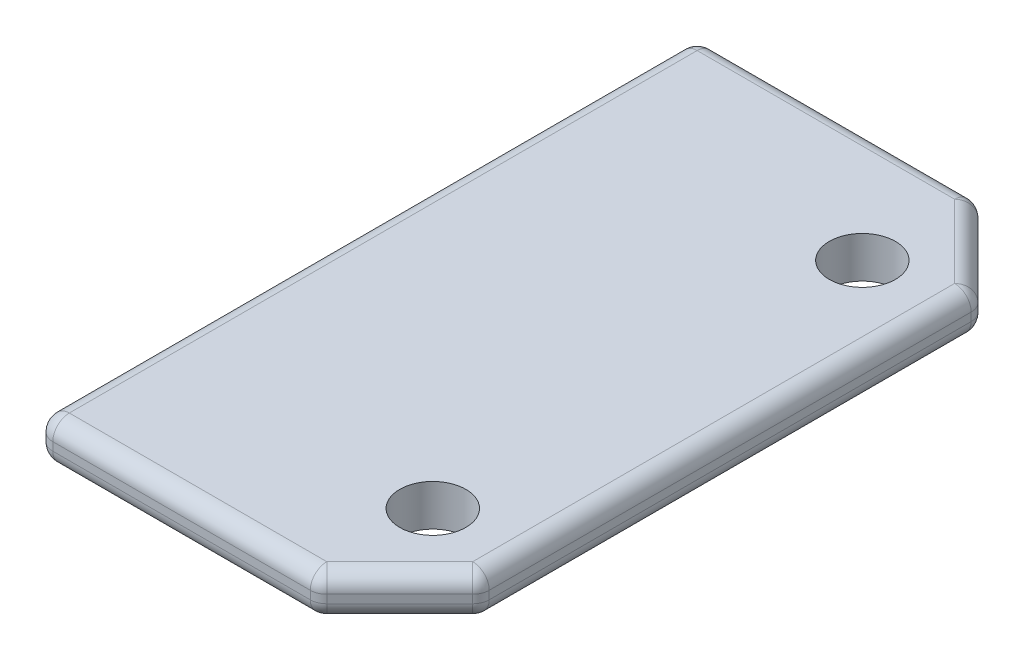
from build123d import *

# Parameters (mm, degrees)
SKETCH_1_R      = 2
EXTRUDE_1_DEPTH = 2.5
FILLET_1_R      = 1


with BuildPart() as part:
    # 草图1 → 凸台-拉伸1 (new body)
    with BuildSketch(Plane(origin=(0, 0, 0), x_dir=(1, 0, 0), z_dir=(0, 1, 0))):
        with BuildLine():
            Line((29.554766525, 4.641792145), (29.554766525, 7.641792145))
            Line((29.554766525, 7.641792145), (29.554766525, 42.641792145))
            ThreePointArc((29.554766525, 42.641792145), (29.847659744, 43.348898926), (30.554766525, 43.641792145))
            Line((30.554766525, 43.641792145), (46.140552963, 43.641792145))
            ThreePointArc((46.140552963, 43.641792145), (46.523236395, 43.565671677), (46.847659744, 43.348898926))
            Line((46.847659744, 43.348898926), (51.261873307, 38.934685364))
            ThreePointArc((51.261873307, 38.934685364), (51.478646058, 38.610262015), (51.554766525, 38.227578582))
            Line((51.554766525, 38.227578582), (51.554766525, 31.641792145))
            Line((51.554766525, 31.641792145), (51.554766525, 15.641792145))
            Line((51.554766525, 15.641792145), (51.554766525, 9.056005707))
            ThreePointArc((51.554766525, 9.056005707), (51.478646058, 8.673322275), (51.261873307, 8.348898926))
            Line((51.261873307, 8.348898926), (46.847659744, 3.934685364))
            ThreePointArc((46.847659744, 3.934685364), (46.523236395, 3.717912612), (46.140552963, 3.641792145))
            Line((46.140552963, 3.641792145), (30.554766525, 3.641792145))
            ThreePointArc((30.554766525, 3.641792145), (29.847659744, 3.934685364), (29.554766525, 4.641792145))
        make_face()
        with Locations(Location((46.554766525, 10.641792145, 0), (0, 0, 270))):
            Circle(SKETCH_1_R, mode=Mode.SUBTRACT)
        with Locations(Location((46.554766525, 36.641792145, 0), (0, 0, 270))):
            Circle(SKETCH_1_R, mode=Mode.SUBTRACT)
    extrude(amount=EXTRUDE_1_DEPTH)

    # 圆角1
    fillet_1_edges = [part.edges().sort_by_distance(p)[0] for p in [
        (29.847659744, 2.5, -3.934685364),
        (29.847659744, 0, -43.348898926),
        (38.347659744, 0, -43.641792145),
        (46.523236395, 0, -43.565671677),
        (49.054766525, 0, -41.141792145),
        (51.478646058, 0, -38.610262015),
        (51.554766525, 0, -23.641792145),
        (38.347659744, 2.5, -3.641792145),
        (51.478646058, 0, -8.673322275),
        (49.054766525, 0, -6.141792145),
        (46.523236395, 0, -3.717912612),
        (38.347659744, 0, -3.641792145),
        (29.847659744, 0, -3.934685364),
        (29.554766525, 0, -23.641792145),
        (46.523236395, 2.5, -3.717912612),
        (49.054766525, 2.5, -6.141792145),
        (51.478646058, 2.5, -8.673322275),
        (51.554766525, 2.5, -23.641792145),
        (51.478646058, 2.5, -38.610262015),
        (49.054766525, 2.5, -41.141792145),
        (29.554766525, 2.5, -23.641792145),
        (46.523236395, 2.5, -43.565671677),
        (38.347659744, 2.5, -43.641792145),
        (29.847659744, 2.5, -43.348898926),
    ]]
    fillet(fillet_1_edges, radius=FILLET_1_R)


solid = part.part
